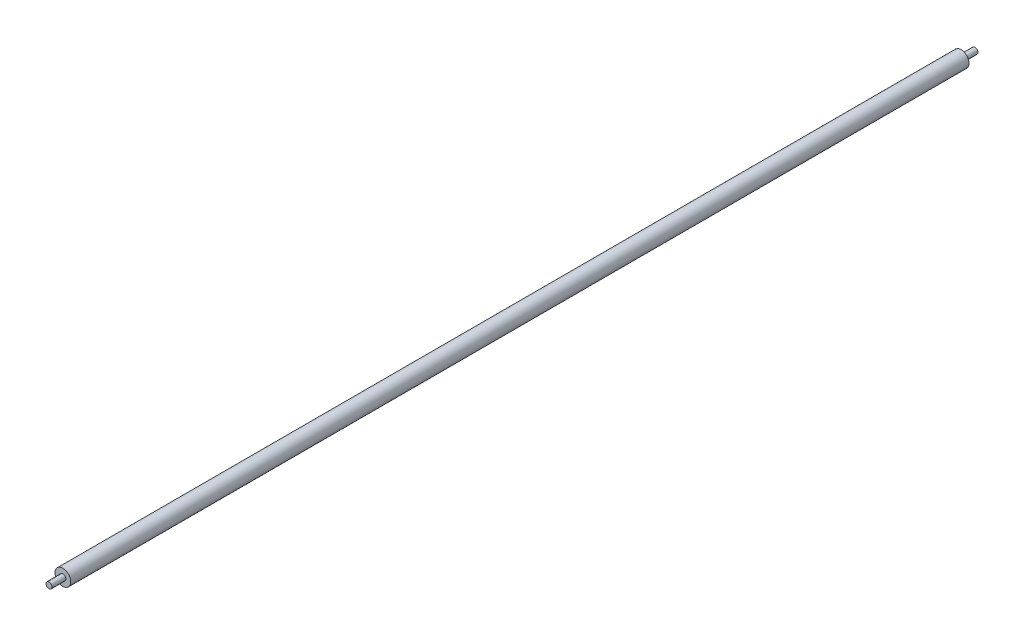
from build123d import *

# Parameters (mm, degrees)
SKETCH1_R           = 0.3219
BOSS_EXTRUDE1_DEPTH = 100
BOSS_EXTRUDE2_START = 1.5
SKETCH1_3_R         = 0.85
SKETCH1_3_R_2       = 0.3219
BOSS_EXTRUDE2_DEPTH = 97


with BuildPart() as part:
    # Sketch1 → Boss-Extrude1 (new body)
    with BuildSketch(Plane.XY):
        Circle(SKETCH1_R)
    extrude(amount=BOSS_EXTRUDE1_DEPTH)


with BuildPart() as body_2:
    # Sketch1<3> → Boss-Extrude2 (new body)
    with BuildSketch(Plane.XY.offset(BOSS_EXTRUDE2_START)):
        with Locations(Location((0, 0, 0), (0, 0, 180))):
            Circle(SKETCH1_3_R)
        Circle(SKETCH1_3_R_2, mode=Mode.SUBTRACT)
    extrude(amount=BOSS_EXTRUDE2_DEPTH)


solid = Compound([part.part, body_2.part])
